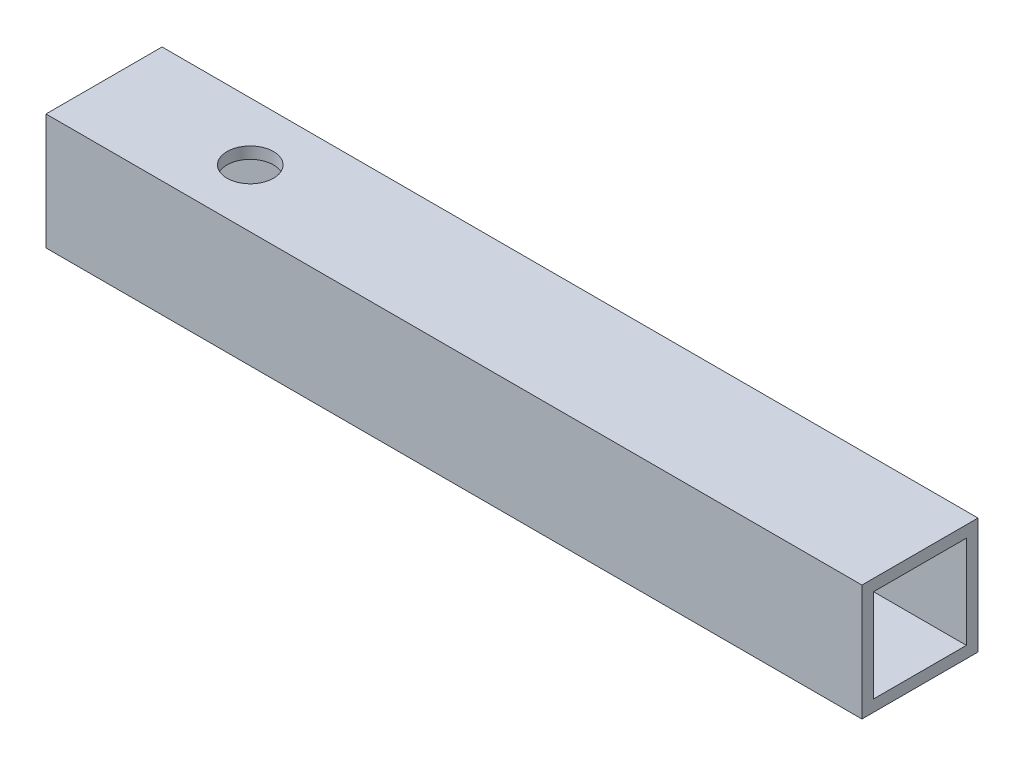
from build123d import *

# Parameters (mm, degrees)
SKETCH2_W           = 3.96875
SKETCH2_H           = 3.96875
BOSS_EXTRUDE1_DEPTH = 27.9
SKETCH3_W           = 3.175
SKETCH3_H           = 3.175
CUT_EXTRUDE1_DEPTH  = 29.04078259
SKETCH4_R           = 0.79375
CUT_EXTRUDE2_DEPTH  = 10


with BuildPart() as part:
    # Sketch2 → Boss-Extrude1 (new body)
    with BuildSketch(Plane(origin=(0, 0, 0), x_dir=(0, 0, -1), z_dir=(1, 0, 0))):
        Rectangle(SKETCH2_W, SKETCH2_H)
    extrude(amount=BOSS_EXTRUDE1_DEPTH)

    # Sketch3 → Cut-Extrude1 (cut, through all)
    with BuildSketch(Plane.ZY):
        Rectangle(SKETCH3_W, SKETCH3_H)
    extrude(amount=-CUT_EXTRUDE1_DEPTH, mode=Mode.SUBTRACT)

    # Sketch4 → Cut-Extrude2 (cut)
    with BuildSketch(Plane(origin=(0, 1.984375, 0), x_dir=(1, 0, 0), z_dir=(0, 1, 0))):
        with Locations(Location((5, 0, 0), (0, 0, 270))):
            Circle(SKETCH4_R)
    extrude(amount=-CUT_EXTRUDE2_DEPTH, mode=Mode.SUBTRACT)


solid = part.part
